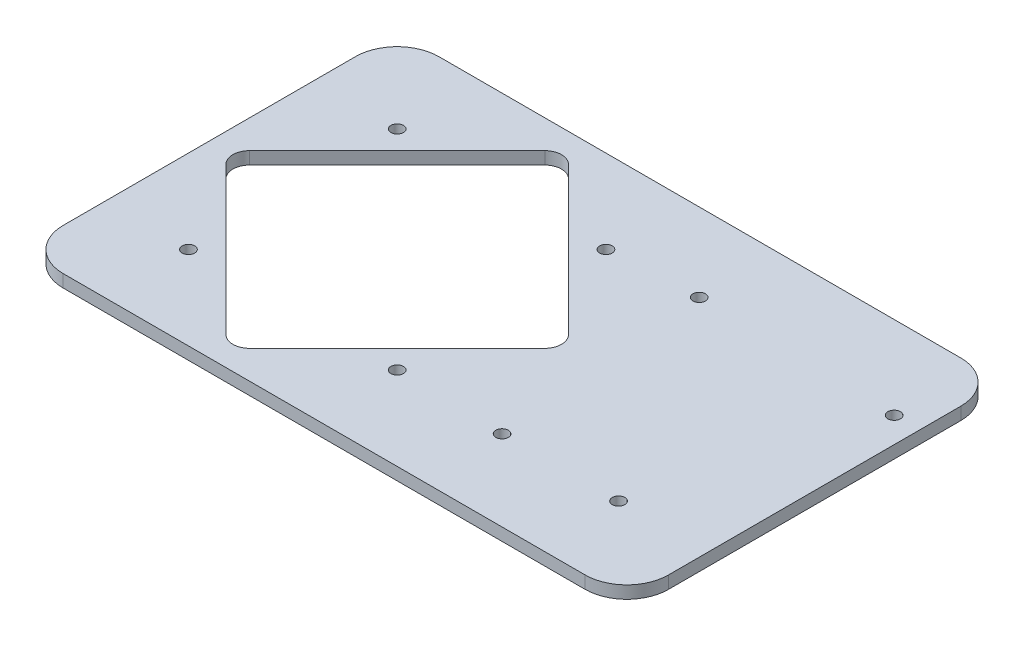
from build123d import *

# Parameters (mm, degrees)
BASE_W                     = 145
BASE_H                     = 90
RESSALTO_EXTRUS_O1_DEPTH   = 3
CORTE_EXTRUS_O1_DEPTH      = 86.382960829
FURO_DE_DI_METRO_3_0_3_1_D = 3
FURO_DE_DI_METRO_3_0_3_7_D = 3
FILETE1_R                  = 10
FILETE2_R                  = 4


with BuildPart() as part:
    # Base → Ressalto-extrusão1 (new body)
    with BuildSketch(Plane(origin=(0, 0, 0), x_dir=(1, 0, 0), z_dir=(0, 1, 0))):
        Rectangle(BASE_W, BASE_H)
    extrude(amount=-RESSALTO_EXTRUS_O1_DEPTH)

    # Recorte → Corte-extrusão1 (cut, through all)
    with BuildSketch(Plane(origin=(0, 0, 0), x_dir=(1, 0, 0), z_dir=(0, 1, 0))):
        Polygon((-68.512193309, 0), (-27.5, 41.012193309), (13.512193309, 0), (-27.5, -41.012193309), align=None)
    extrude(amount=-CORTE_EXTRUS_O1_DEPTH, mode=Mode.SUBTRACT)

    # Furo de diâmetro Ø3.0 (3)1 (through all)
    with Locations(Plane(origin=(0, 0, 0), x_dir=(1, 0, 0), z_dir=(0, 1, 0))):
        with Locations((-52.5, 25), (-2.5, 25), (-2.5, -25), (-52.5, -25)):
            Hole(FURO_DE_DI_METRO_3_0_3_1_D / 2)

    # Furo de diâmetro Ø3.0 (3)7 (through all)
    with Locations(Plane(origin=(0, 0, 0), x_dir=(1, 0, 0), z_dir=(0, 1, 0))):
        with Locations((18.6, 26.225), (23.3, -25.675), (51.2, -25.675), (66.4, 25.125)):
            Hole(FURO_DE_DI_METRO_3_0_3_7_D / 2)

    # Filete1
    filete1_edges = [part.edges().sort_by_distance(p)[0] for p in [
        (72.5, -1.5, 45),
        (-72.5, -1.5, 45),
        (-72.5, -1.5, -45),
        (72.5, -1.5, -45),
    ]]
    fillet(filete1_edges, radius=FILETE1_R)

    # Filete2
    filete2_edges = [part.edges().sort_by_distance(p)[0] for p in [
        (-68.512193309, -1.5, 0),
        (-27.5, -1.5, -41.012193309),
        (13.512193309, -1.5, 0),
        (-27.5, -1.5, 41.012193309),
    ]]
    fillet(filete2_edges, radius=FILETE2_R)


solid = part.part
